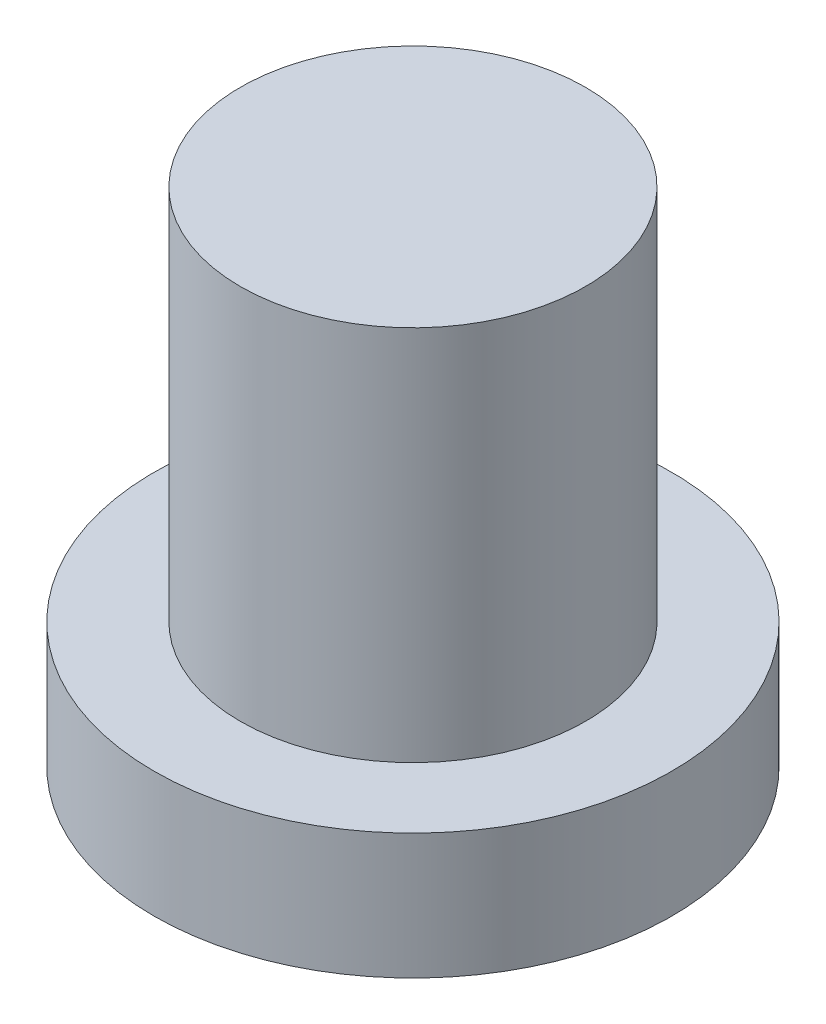
from build123d import *

# Parameters (mm, degrees)
SKETCH2_R           = 2.0625
BOSS_EXTRUDE1_DEPTH = 1
SKETCH3_R           = 1.375
BOSS_EXTRUDE2_DEPTH = 3


with BuildPart() as part:
    # Sketch2 → Boss-Extrude1 (new body)
    with BuildSketch(Plane(origin=(0, 0, 0), x_dir=(1, 0, 0), z_dir=(0, 1, 0))):
        with Locations(Location((0, 0, 0), (0, 0, 270))):
            Circle(SKETCH2_R)
    extrude(amount=BOSS_EXTRUDE1_DEPTH)

    # Sketch3 → Boss-Extrude2 (add)
    with BuildSketch(Plane(origin=(0, 1, 0), x_dir=(1, 0, 0), z_dir=(0, 1, 0))):
        with Locations(Location((0, 0, 0), (0, 0, 270))):
            Circle(SKETCH3_R)
    extrude(amount=BOSS_EXTRUDE2_DEPTH)


solid = part.part
